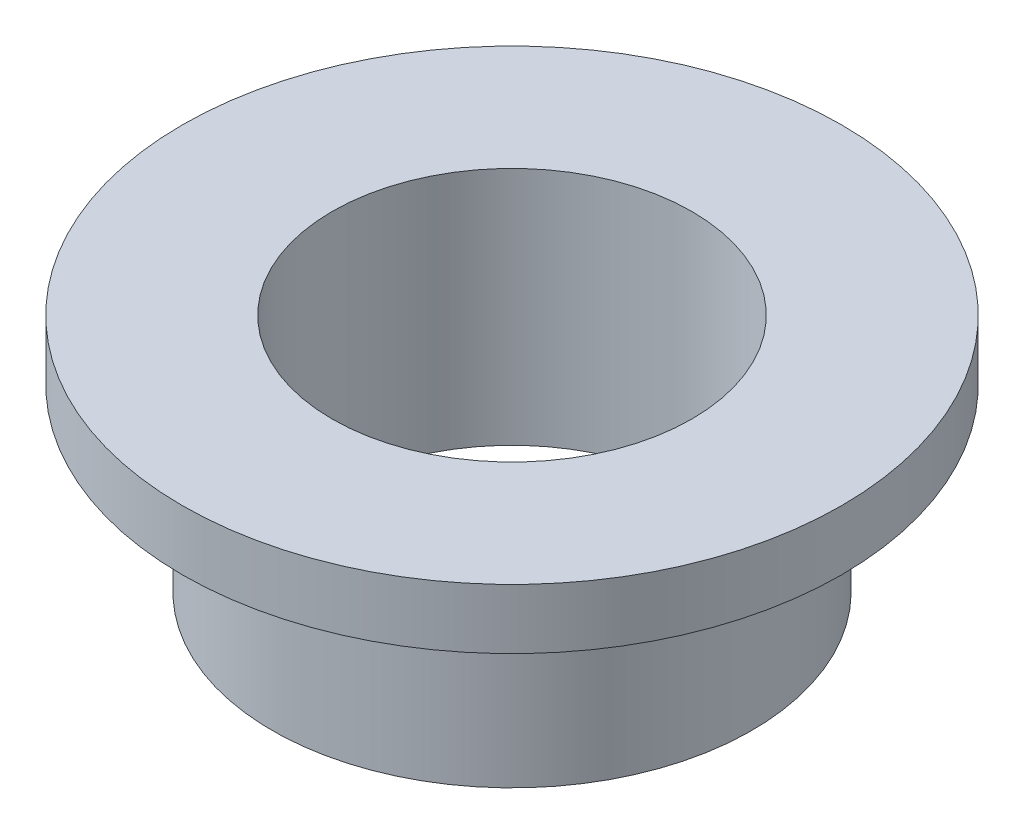
from build123d import *

# Parameters (mm, degrees)
SKETCH1_R           = 6.35
SKETCH1_R_2         = 4.7625
BOSS_EXTRUDE1_DEPTH = 4.7625
SKETCH2_R           = 8.73125
SKETCH2_R_2         = 4.7625
BOSS_EXTRUDE2_DEPTH = 1.5875


with BuildPart() as part:
    # Sketch1 → Boss-Extrude1 (new body)
    with BuildSketch(Plane(origin=(0, 0, 0), x_dir=(1, 0, 0), z_dir=(0, 1, 0))):
        with Locations(Location((0, 0, 0), (0, 0, 90))):
            Circle(SKETCH1_R)
        with Locations(Location((0, 0, 0), (0, 0, 90))):
            Circle(SKETCH1_R_2, mode=Mode.SUBTRACT)
    extrude(amount=BOSS_EXTRUDE1_DEPTH)

    # Sketch2 → Boss-Extrude2 (add)
    with BuildSketch(Plane(origin=(0, 4.7625, 0), x_dir=(1, 0, 0), z_dir=(0, 1, 0))):
        with Locations(Location((0, 0, 0), (0, 0, 270))):
            Circle(SKETCH2_R)
        with Locations(Location((0, 0, 0), (0, 0, 90))):
            Circle(SKETCH2_R_2, mode=Mode.SUBTRACT)
    extrude(amount=BOSS_EXTRUDE2_DEPTH)


solid = part.part
